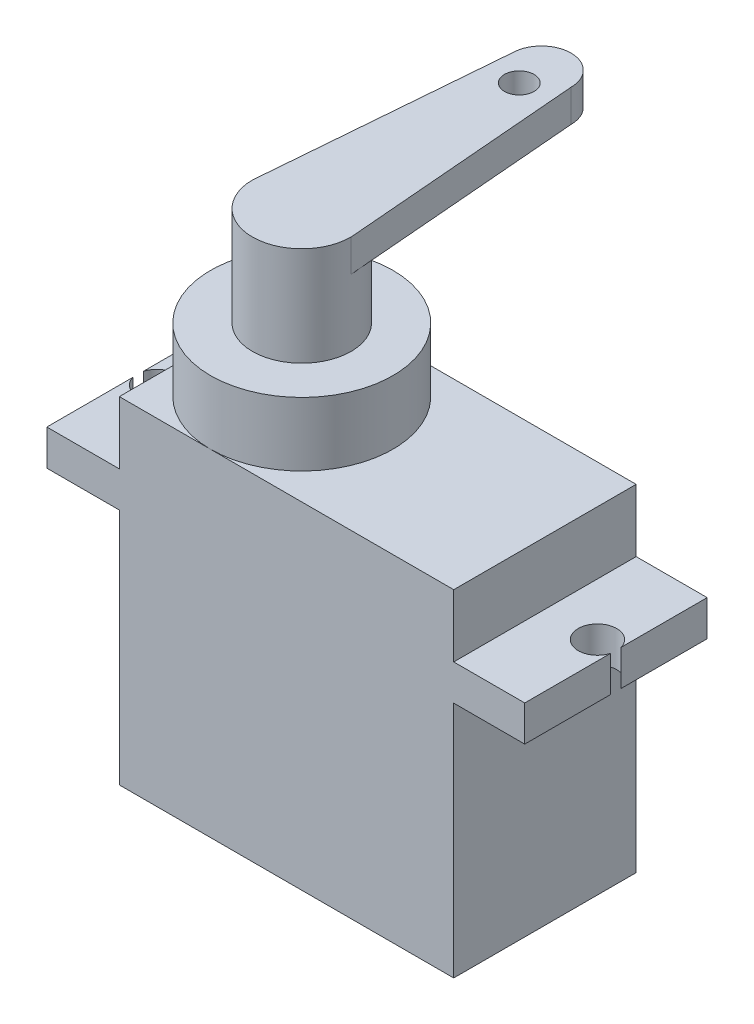
from build123d import *

# Parameters (mm, degrees)
SKETCH1_W           = 22.6
SKETCH1_H           = 12.33
BOSS_EXTRUDE1_DEPTH = 16.09
SKETCH2_W           = 32.3
SKETCH2_H           = 12.33
BOSS_EXTRUDE2_DEPTH = 2.41
SKETCH3_W           = 22.6
SKETCH3_H           = 12.33
BOSS_EXTRUDE3_DEPTH = 4.23
BOSS_EXTRUDE4_DEPTH = 4.31
SKETCH5_R           = 3.335
BOSS_EXTRUDE5_DEPTH = 4.52
BOSS_EXTRUDE8_DEPTH = 2.18
SKETCH8_R           = 1.3
CUT_EXTRUDE3_DEPTH  = 4
SKETCH9_R           = 1.3
CUT_EXTRUDE4_DEPTH  = 4
SKETCH10_R          = 1
CUT_EXTRUDE5_DEPTH  = 10


with BuildPart() as part:
    # Sketch1 → Boss-Extrude1 (new body)
    with BuildSketch(Plane(origin=(0, 0, 0), x_dir=(1, 0, 0), z_dir=(0, 1, 0))):
        with Locations((11.3, 6.165)):
            Rectangle(SKETCH1_W, SKETCH1_H)
    extrude(amount=BOSS_EXTRUDE1_DEPTH)

    # Sketch2 → Boss-Extrude2 (add)
    with BuildSketch(Plane(origin=(0, 16.09, 0), x_dir=(1, 0, 0), z_dir=(0, 1, 0))):
        with Locations((11.25, 6.165)):
            Rectangle(SKETCH2_W, SKETCH2_H)
    extrude(amount=BOSS_EXTRUDE2_DEPTH)

    # Sketch3 → Boss-Extrude3 (add)
    with BuildSketch(Plane(origin=(0, 18.5, 0), x_dir=(1, 0, 0), z_dir=(0, 1, 0))):
        with Locations((11.3, 6.165)):
            Rectangle(SKETCH3_W, SKETCH3_H)
    extrude(amount=BOSS_EXTRUDE3_DEPTH)

    # Sketch4 → Boss-Extrude4 (add)
    with BuildSketch(Plane(origin=(0, 22.73, 0), x_dir=(1, 0, 0), z_dir=(0, 1, 0))):
        with BuildLine():
            ThreePointArc((0, 6.165), (6.165, 12.33), (12.33, 6.165))
            ThreePointArc((12.33, 6.165), (6.165, 0), (0, 6.165))
        make_face()
    extrude(amount=BOSS_EXTRUDE4_DEPTH)

    # Sketch5 → Boss-Extrude5 (add)
    with BuildSketch(Plane(origin=(0, 27.04, 0), x_dir=(1, 0, 0), z_dir=(0, 1, 0))):
        with Locations(Location((6.165, 6.165, 0), (0, 0, 270))):
            Circle(SKETCH5_R)
    extrude(amount=BOSS_EXTRUDE5_DEPTH)

    # Sketch6 → Boss-Extrude8 (add)
    with BuildSketch(Plane(origin=(0, 31.56, 0), x_dir=(1, 0, 0), z_dir=(0, 1, 0))):
        with BuildLine():
            ThreePointArc((9.455009686, 6.710949872), (6.165, 9.5), (2.874990314, 6.710949872))
            Line((2.874990314, 6.710949872), (2.83, 6.165))
            ThreePointArc((2.83, 6.165), (6.165, 2.83), (9.5, 6.165))
            Line((9.5, 6.165), (9.455009686, 6.710949872))
        make_face()
        with BuildLine():
            ThreePointArc((8.165, 22.365), (6.165, 24.365), (4.165, 22.365))
            Line((4.165, 22.365), (2.874990314, 6.710949872))
            ThreePointArc((2.874990314, 6.710949872), (6.165, 9.5), (9.455009686, 6.710949872))
            Line((9.455009686, 6.710949872), (8.165, 22.365))
        make_face()
    extrude(amount=BOSS_EXTRUDE8_DEPTH)

    # Sketch8 → Cut-Extrude3 (cut)
    with BuildSketch(Plane(origin=(0, 18.5, 0), x_dir=(1, 0, 0), z_dir=(0, 1, 0))):
        with Locations((-3.65, 6.165)):
            Circle(SKETCH8_R)
    extrude(amount=-CUT_EXTRUDE3_DEPTH, mode=Mode.SUBTRACT)

    # Sketch9 → Cut-Extrude4 (cut)
    with BuildSketch(Plane(origin=(0, 18.5, 0), x_dir=(1, 0, 0), z_dir=(0, 1, 0))):
        with Locations((26.15, 6.165)):
            Circle(SKETCH9_R)
    extrude(amount=-CUT_EXTRUDE4_DEPTH, mode=Mode.SUBTRACT)

    # Sketch10 → Cut-Extrude5 (cut)
    with BuildSketch(Plane(origin=(0, 33.74, 0), x_dir=(1, 0, 0), z_dir=(0, 1, 0))):
        with Locations(Location((6.165, 20.865, 0), (0, 0, 270))):
            Circle(SKETCH10_R)
    extrude(amount=-CUT_EXTRUDE5_DEPTH, mode=Mode.SUBTRACT)


solid = part.part
